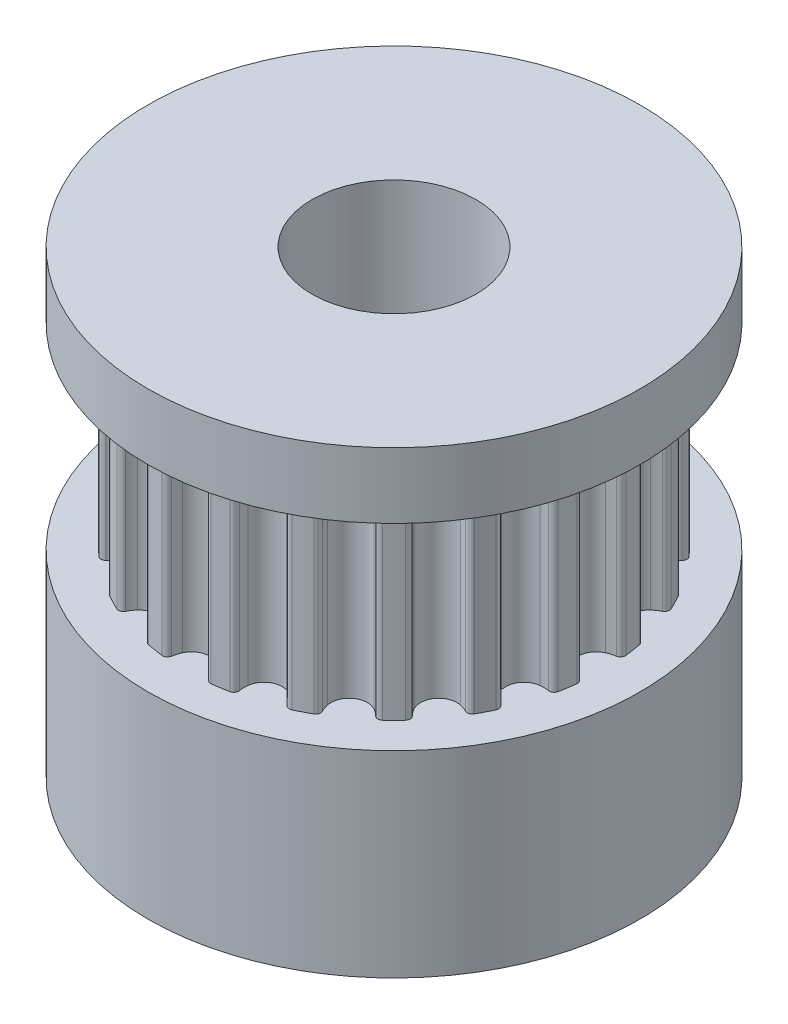
from build123d import *

# Parameters (mm, degrees)
SKETCH1_R                = 2.5
BOSS_EXTRUDE1_DEPTH      = 10
SKETCH3_R                = 7.5
SKETCH3_R_2              = 2.5
BOSS_EXTRUDE2_DEPTH      = 1
BOSS_EXTRUDE3_DEPTH      = 3
BOSS_EXTRUDE3_DEPTH_BACK = 3
SKETCH4_R                = 7.5
SKETCH4_R_2              = 2.5


with BuildPart() as part:
    # Sketch1 → Boss-Extrude1 (new body)
    with BuildSketch(Plane(origin=(0, 0, 0), x_dir=(1, 0, 0), z_dir=(0, 1, 0))):
        with BuildLine():
            ThreePointArc((-3.243710812, 6.935559554), (-3.301343371, 7.031664937), (-3.409493831, 7.061011737))
            ThreePointArc((-3.409493831, 7.061011737), (-3.656864222, 7.026791315), (-3.902702138, 6.982895216))
            ThreePointArc((-3.902702138, 6.982895216), (-3.996490677, 6.92156442), (-4.021604301, 6.812353329))
            ThreePointArc((-4.021604301, 6.812353329), (-4.009629163, 6.680363761), (-4.015213547, 6.547949771))
            ThreePointArc((-4.015213547, 6.547949771), (-4.396132841, 6.079349677), (-4.979739248, 6.234556373))
            ThreePointArc((-4.979739248, 6.234556373), (-5.0620881, 6.338399123), (-5.129981532, 6.452219736))
            ThreePointArc((-5.129981532, 6.452219736), (-5.214491549, 6.525811947), (-5.326417408, 6.520302082))
            ThreePointArc((-5.326417408, 6.520302082), (-5.551105939, 6.411314871), (-5.77134705, 6.293599107))
            ThreePointArc((-5.77134705, 6.293599107), (-5.841592993, 6.206287802), (-5.831729386, 6.094661345))
            ThreePointArc((-5.831729386, 6.094661345), (-5.779553334, 5.972832327), (-5.743946225, 5.84517347))
            ThreePointArc((-5.743946225, 5.84517347), (-5.96141661, 5.281797762), (-6.564420793, 5.249063804))
            ThreePointArc((-6.564420793, 5.249063804), (-6.674828379, 5.322376933), (-6.774571373, 5.409646544))
            ThreePointArc((-6.774571373, 5.409646544), (-6.87768642, 5.453521864), (-6.982431596, 5.413694679))
            ThreePointArc((-6.982431596, 5.413694679), (-7.162444187, 5.240609107), (-7.335529759, 5.060596516))
            ThreePointArc((-7.335529759, 5.060596516), (-7.375356944, 4.95585134), (-7.331481624, 4.852736294))
            ThreePointArc((-7.331481624, 4.852736294), (-7.244212012, 4.752993299), (-7.170898883, 4.642585713))
            ThreePointArc((-7.170898883, 4.642585713), (-7.203632841, 4.03958153), (-7.76700855, 3.822111145))
            ThreePointArc((-7.76700855, 3.822111145), (-7.894667407, 3.857718254), (-8.016496425, 3.909894307))
            ThreePointArc((-8.016496425, 3.909894307), (-8.128122881, 3.919757914), (-8.215434186, 3.84951197))
            ThreePointArc((-8.215434186, 3.84951197), (-8.333149951, 3.62927086), (-8.442137162, 3.404582329))
            ThreePointArc((-8.442137162, 3.404582329), (-8.447647026, 3.29265647), (-8.374054816, 3.208146452))
            ThreePointArc((-8.374054816, 3.208146452), (-8.260234203, 3.14025302), (-8.156391453, 3.057904169))
            ThreePointArc((-8.156391453, 3.057904169), (-8.001184757, 2.474297762), (-8.469784851, 2.093378467))
            ThreePointArc((-8.469784851, 2.093378467), (-8.602198841, 2.087794084), (-8.734188409, 2.099769222))
            ThreePointArc((-8.734188409, 2.099769222), (-8.8433995, 2.074655597), (-8.904730295, 1.980867058))
            ThreePointArc((-8.904730295, 1.980867058), (-8.948626394, 1.735029143), (-8.982846817, 1.487658751))
            ThreePointArc((-8.982846817, 1.487658751), (-8.953500017, 1.379508291), (-8.857394634, 1.321875732))
            ThreePointArc((-8.857394634, 1.321875732), (-8.728164574, 1.292477746), (-8.603957055, 1.246248508))
            ThreePointArc((-8.603957055, 1.246248508), (-8.276002418, 0.739167338), (-8.603957055, 0.232086169))
            ThreePointArc((-8.603957055, 0.232086169), (-8.728164574, 0.185856931), (-8.857394634, 0.156458944))
            ThreePointArc((-8.857394634, 0.156458944), (-8.953500017, 0.098826385), (-8.982846817, -0.009324074))
            ThreePointArc((-8.982846817, -0.009324074), (-8.948626394, -0.256694466), (-8.904730295, -0.502532381))
            ThreePointArc((-8.904730295, -0.502532381), (-8.8433995, -0.596320921), (-8.734188409, -0.621434545))
            ThreePointArc((-8.734188409, -0.621434545), (-8.602198841, -0.609459407), (-8.469784851, -0.615043791))
            ThreePointArc((-8.469784851, -0.615043791), (-8.001184757, -0.995963085), (-8.156391453, -1.579569492))
            ThreePointArc((-8.156391453, -1.579569492), (-8.260234203, -1.661918344), (-8.374054816, -1.729811775))
            ThreePointArc((-8.374054816, -1.729811775), (-8.447647026, -1.814321793), (-8.442137162, -1.926247652))
            ThreePointArc((-8.442137162, -1.926247652), (-8.333149951, -2.150936183), (-8.215434186, -2.371177294))
            ThreePointArc((-8.215434186, -2.371177294), (-8.128122881, -2.441423237), (-8.016496425, -2.43155963))
            ThreePointArc((-8.016496425, -2.43155963), (-7.894667407, -2.379383578), (-7.76700855, -2.343776469))
            ThreePointArc((-7.76700855, -2.343776469), (-7.203632841, -2.561246853), (-7.170898883, -3.164251036))
            ThreePointArc((-7.170898883, -3.164251036), (-7.244212012, -3.274658623), (-7.331481624, -3.374401617))
            ThreePointArc((-7.331481624, -3.374401617), (-7.375356944, -3.477516664), (-7.335529759, -3.58226184))
            ThreePointArc((-7.335529759, -3.58226184), (-7.162444187, -3.762274431), (-6.982431596, -3.935360003))
            ThreePointArc((-6.982431596, -3.935360003), (-6.87768642, -3.975187188), (-6.774571373, -3.931311868))
            ThreePointArc((-6.774571373, -3.931311868), (-6.674828379, -3.844042256), (-6.564420793, -3.770729127))
            ThreePointArc((-6.564420793, -3.770729127), (-5.96141661, -3.803463085), (-5.743946225, -4.366838793))
            ThreePointArc((-5.743946225, -4.366838793), (-5.779553334, -4.494497651), (-5.831729386, -4.616326668))
            ThreePointArc((-5.831729386, -4.616326668), (-5.841592993, -4.727953125), (-5.77134705, -4.81526443))
            ThreePointArc((-5.77134705, -4.81526443), (-5.551105939, -4.932980195), (-5.326417408, -5.041967406))
            ThreePointArc((-5.326417408, -5.041967406), (-5.214491549, -5.04747727), (-5.129981532, -4.97388506))
            ThreePointArc((-5.129981532, -4.97388506), (-5.0620881, -4.860064446), (-4.979739248, -4.756221697))
            ThreePointArc((-4.979739248, -4.756221697), (-4.396132841, -4.601015001), (-4.015213547, -5.069615095))
            ThreePointArc((-4.015213547, -5.069615095), (-4.009629163, -5.202029084), (-4.021604301, -5.334018653))
            ThreePointArc((-4.021604301, -5.334018653), (-3.996490677, -5.443229744), (-3.902702138, -5.504560539))
            ThreePointArc((-3.902702138, -5.504560539), (-3.656864222, -5.548456638), (-3.40949383, -5.582677061))
            ThreePointArc((-3.40949383, -5.582677061), (-3.301343371, -5.553330261), (-3.243710812, -5.457224878))
            ThreePointArc((-3.243710812, -5.457224878), (-3.214312825, -5.327994818), (-3.168083588, -5.203787299))
            ThreePointArc((-3.168083588, -5.203787299), (-2.661002418, -4.875832662), (-2.153921248, -5.203787299))
            ThreePointArc((-2.153921248, -5.203787299), (-2.107692011, -5.327994818), (-2.078294024, -5.457224878))
            ThreePointArc((-2.078294024, -5.457224878), (-2.020661465, -5.553330261), (-1.912511005, -5.582677061))
            ThreePointArc((-1.912511005, -5.582677061), (-1.665140614, -5.548456638), (-1.419302698, -5.504560539))
            ThreePointArc((-1.419302698, -5.504560539), (-1.325514159, -5.443229744), (-1.300400535, -5.334018653))
            ThreePointArc((-1.300400535, -5.334018653), (-1.312375672, -5.202029084), (-1.306791289, -5.069615095))
            ThreePointArc((-1.306791289, -5.069615095), (-0.925871995, -4.601015001), (-0.342265588, -4.756221697))
            ThreePointArc((-0.342265588, -4.756221697), (-0.259916736, -4.860064446), (-0.192023304, -4.97388506))
            ThreePointArc((-0.192023304, -4.97388506), (-0.107513287, -5.04747727), (0.004412572, -5.041967406))
            ThreePointArc((0.004412572, -5.041967406), (0.229101103, -4.932980195), (0.449342214, -4.81526443))
            ThreePointArc((0.449342214, -4.81526443), (0.519588157, -4.727953125), (0.509724551, -4.616326668))
            ThreePointArc((0.509724551, -4.616326668), (0.457548498, -4.494497651), (0.421941389, -4.366838793))
            ThreePointArc((0.421941389, -4.366838793), (0.639411774, -3.803463085), (1.242415957, -3.770729127))
            ThreePointArc((1.242415957, -3.770729127), (1.352823543, -3.844042256), (1.452566537, -3.931311868))
            ThreePointArc((1.452566537, -3.931311868), (1.555681584, -3.975187188), (1.66042676, -3.935360003))
            ThreePointArc((1.66042676, -3.935360003), (1.840439351, -3.762274431), (2.013524923, -3.58226184))
            ThreePointArc((2.013524923, -3.58226184), (2.053352108, -3.477516664), (2.009476788, -3.374401617))
            ThreePointArc((2.009476788, -3.374401617), (1.922207176, -3.274658623), (1.848894047, -3.164251036))
            ThreePointArc((1.848894047, -3.164251036), (1.881628005, -2.561246853), (2.445003714, -2.343776469))
            ThreePointArc((2.445003714, -2.343776469), (2.572662571, -2.379383578), (2.694491589, -2.43155963))
            ThreePointArc((2.694491589, -2.43155963), (2.806118045, -2.441423237), (2.89342935, -2.371177294))
            ThreePointArc((2.89342935, -2.371177294), (3.011145115, -2.150936183), (3.120132326, -1.926247652))
            ThreePointArc((3.120132326, -1.926247652), (3.125642191, -1.814321793), (3.05204998, -1.729811775))
            ThreePointArc((3.05204998, -1.729811775), (2.938229367, -1.661918344), (2.834386617, -1.579569492))
            ThreePointArc((2.834386617, -1.579569492), (2.679179921, -0.995963085), (3.147780015, -0.615043791))
            ThreePointArc((3.147780015, -0.615043791), (3.280194005, -0.609459407), (3.412183573, -0.621434545))
            ThreePointArc((3.412183573, -0.621434545), (3.521394664, -0.596320921), (3.582725459, -0.502532381))
            ThreePointArc((3.582725459, -0.502532381), (3.626621558, -0.256694466), (3.660841981, -0.009324074))
            ThreePointArc((3.660841981, -0.009324074), (3.631495181, 0.098826385), (3.535389798, 0.156458944))
            ThreePointArc((3.535389798, 0.156458944), (3.406159738, 0.185856931), (3.281952219, 0.232086169))
            ThreePointArc((3.281952219, 0.232086169), (2.953997582, 0.739167338), (3.281952219, 1.246248508))
            ThreePointArc((3.281952219, 1.246248508), (3.406159738, 1.292477746), (3.535389798, 1.321875732))
            ThreePointArc((3.535389798, 1.321875732), (3.631495181, 1.379508291), (3.660841981, 1.487658751))
            ThreePointArc((3.660841981, 1.487658751), (3.626621558, 1.735029143), (3.582725459, 1.980867058))
            ThreePointArc((3.582725459, 1.980867058), (3.521394664, 2.074655597), (3.412183573, 2.099769222))
            ThreePointArc((3.412183573, 2.099769222), (3.280194005, 2.087794084), (3.147780015, 2.093378467))
            ThreePointArc((3.147780015, 2.093378467), (2.679179921, 2.474297762), (2.834386617, 3.057904169))
            ThreePointArc((2.834386617, 3.057904169), (2.938229367, 3.14025302), (3.05204998, 3.208146452))
            ThreePointArc((3.05204998, 3.208146452), (3.125642191, 3.29265647), (3.120132326, 3.404582329))
            ThreePointArc((3.120132326, 3.404582329), (3.011145115, 3.62927086), (2.89342935, 3.84951197))
            ThreePointArc((2.89342935, 3.84951197), (2.806118045, 3.919757914), (2.694491589, 3.909894307))
            ThreePointArc((2.694491589, 3.909894307), (2.572662571, 3.857718254), (2.445003714, 3.822111145))
            ThreePointArc((2.445003714, 3.822111145), (1.881628005, 4.03958153), (1.848894047, 4.642585713))
            ThreePointArc((1.848894047, 4.642585713), (1.922207176, 4.752993299), (2.009476788, 4.852736294))
            ThreePointArc((2.009476788, 4.852736294), (2.053352108, 4.95585134), (2.013524923, 5.060596516))
            ThreePointArc((2.013524923, 5.060596516), (1.840439351, 5.240609107), (1.66042676, 5.413694679))
            ThreePointArc((1.66042676, 5.413694679), (1.555681584, 5.453521864), (1.452566537, 5.409646544))
            ThreePointArc((1.452566537, 5.409646544), (1.352823543, 5.322376933), (1.242415957, 5.249063804))
            ThreePointArc((1.242415957, 5.249063804), (0.639411774, 5.281797762), (0.421941389, 5.84517347))
            ThreePointArc((0.421941389, 5.84517347), (0.457548498, 5.972832327), (0.509724551, 6.094661345))
            ThreePointArc((0.509724551, 6.094661345), (0.519588157, 6.206287802), (0.449342214, 6.293599107))
            ThreePointArc((0.449342214, 6.293599107), (0.229101103, 6.411314871), (0.004412572, 6.520302082))
            ThreePointArc((0.004412572, 6.520302082), (-0.107513287, 6.525811947), (-0.192023304, 6.452219736))
            ThreePointArc((-0.192023304, 6.452219736), (-0.259916736, 6.338399123), (-0.342265588, 6.234556373))
            ThreePointArc((-0.342265588, 6.234556373), (-0.925871995, 6.079349677), (-1.306791289, 6.547949771))
            ThreePointArc((-1.306791289, 6.547949771), (-1.312375672, 6.680363761), (-1.300400535, 6.812353329))
            ThreePointArc((-1.300400535, 6.812353329), (-1.325514159, 6.92156442), (-1.419302698, 6.982895216))
            ThreePointArc((-1.419302698, 6.982895216), (-1.665140614, 7.026791315), (-1.912511005, 7.061011737))
            ThreePointArc((-1.912511005, 7.061011737), (-2.020661465, 7.031664937), (-2.078294024, 6.935559554))
            ThreePointArc((-2.078294024, 6.935559554), (-2.107692011, 6.806329494), (-2.153921248, 6.682121976))
            ThreePointArc((-2.153921248, 6.682121976), (-2.661002418, 6.354167338), (-3.168083588, 6.682121976))
            ThreePointArc((-3.168083588, 6.682121976), (-3.214312825, 6.806329494), (-3.243710812, 6.935559554))
        make_face()
        with Locations(Location((-2.661002418, 0.739167338, 0), (0, 0, 270))):
            Circle(SKETCH1_R, mode=Mode.SUBTRACT)
    extrude(amount=BOSS_EXTRUDE1_DEPTH)

    # Sketch3 → Boss-Extrude2 (add, symmetric)
    with BuildSketch(Plane(origin=(0, 10, 0), x_dir=(1, 0, 0), z_dir=(0, 1, 0))):
        with Locations(Location((-2.661002418, 0.739167338, 0), (0, 0, 270))):
            Circle(SKETCH3_R)
        with Locations(Location((-2.661002418, 0.739167338, 0), (0, 0, 270))):
            Circle(SKETCH3_R_2, mode=Mode.SUBTRACT)
    extrude(amount=BOSS_EXTRUDE2_DEPTH, both=True)

    # Sketch4 → Boss-Extrude3 (add, two sides: drawn at the far end of the back side and taken through both)
    with BuildSketch(Plane.XZ.offset(-BOSS_EXTRUDE3_DEPTH_BACK)):
        with Locations(Location((-2.661002418, -0.739167338, 0), (0, 0, 90))):
            Circle(SKETCH4_R)
        with Locations(Location((-2.661002418, -0.739167338, 0), (0, 0, 270))):
            Circle(SKETCH4_R_2, mode=Mode.SUBTRACT)
    extrude(amount=BOSS_EXTRUDE3_DEPTH + BOSS_EXTRUDE3_DEPTH_BACK)


solid = part.part
